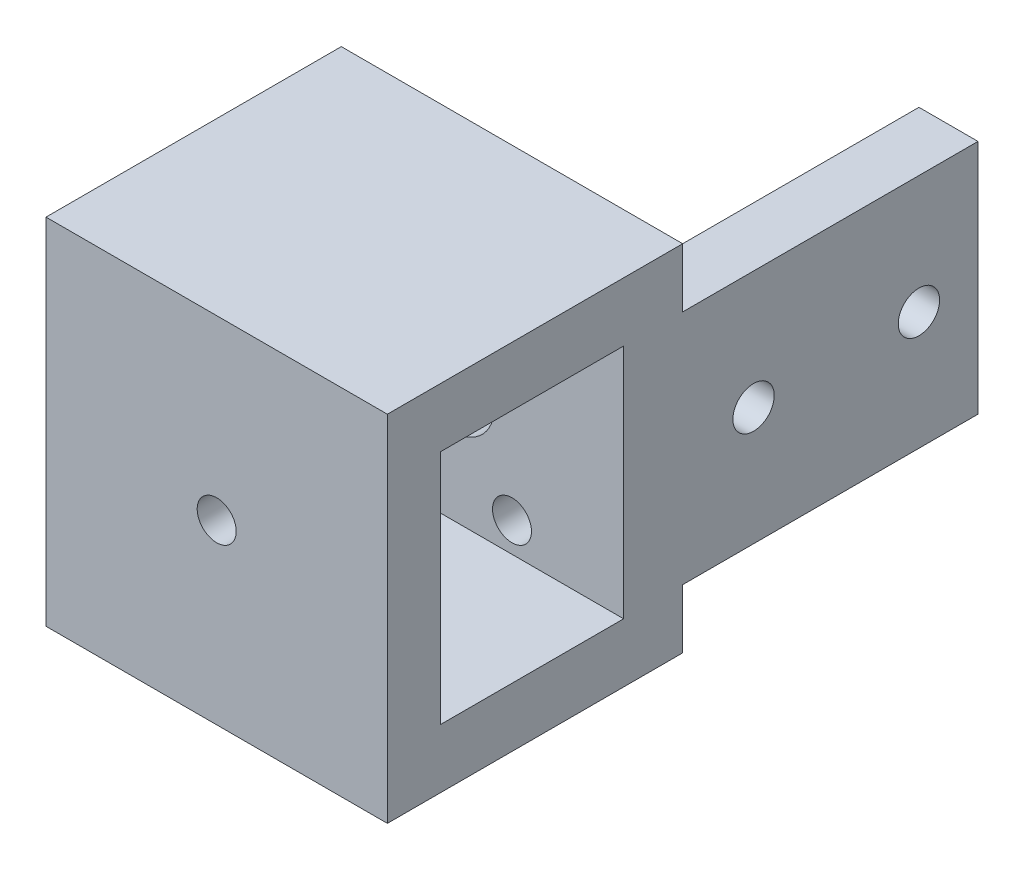
from build123d import *

# Parameters (mm, degrees)
SKETCH_1_W          = 28.9
SKETCH_1_H          = 20
SKETCH_1_R          = 1.65
EXTRUDE_1_DEPTH     = 5
SKETCH_1_5_W        = 28.9
SKETCH_1_5_H        = 5
EXTRUDE_4_DEPTH     = 25
SKETCH_2_W          = 25
SKETCH_2_H          = 20
SKETCH_2_R          = 1.75
EXTRUDE_5_DEPTH     = 5
SKETCH_3_W          = 28.9
SKETCH_3_H          = 20
SKETCH_3_R          = 1.65
EXTRUDE_6_DEPTH     = 4.5
CUT_EXTRUDE_1_REACH = 61.418
SKETCH_4_R          = 3.5


with BuildPart() as part:
    # 草图1 → 凸台-拉伸1 (new body)
    with BuildSketch(Plane.XY):
        with Locations((14.45, 10)):
            Rectangle(SKETCH_1_W, SKETCH_1_H)
        with Locations((9.45, 2.5)):
            Circle(SKETCH_1_R, mode=Mode.SUBTRACT)
        with Locations((19.45, 2.5)):
            Circle(SKETCH_1_R, mode=Mode.SUBTRACT)
        with Locations((9.45, 17.5)):
            Circle(SKETCH_1_R, mode=Mode.SUBTRACT)
        with Locations((19.45, 17.5)):
            Circle(SKETCH_1_R, mode=Mode.SUBTRACT)
    extrude(amount=EXTRUDE_1_DEPTH)

    # 草图1<5> → 凸台-拉伸4 (add)
    with BuildSketch(Plane.XY):
        with Locations((14.45, 22.5)):
            Rectangle(SKETCH_1_5_W, SKETCH_1_5_H)
        with Locations((14.45, -2.5)):
            Rectangle(SKETCH_1_5_W, SKETCH_1_5_H)
    extrude(amount=EXTRUDE_4_DEPTH)

    # 草图2 → 凸台-拉伸5 (add)
    with BuildSketch(Plane(origin=(28.9, 0, 0), x_dir=(0, 0, -1), z_dir=(1, 0, 0))):
        with Locations((12.5, 10)):
            Rectangle(SKETCH_2_W, SKETCH_2_H)
        with Locations((20, 10)):
            Circle(SKETCH_2_R, mode=Mode.SUBTRACT)
        with Locations((6, 10)):
            Circle(SKETCH_2_R, mode=Mode.SUBTRACT)
    extrude(amount=-EXTRUDE_5_DEPTH)

    # 草图3 → 凸台-拉伸6 (add)
    with BuildSketch(Plane.XY.offset(25)):
        with Locations((14.45, 10)):
            Rectangle(SKETCH_3_W, SKETCH_3_H)
        with Locations((14.45, 10)):
            Circle(SKETCH_3_R, mode=Mode.SUBTRACT)
    extrude(amount=-EXTRUDE_6_DEPTH)

    # 草图4 → 切除-拉伸1 (cut, up to next)
    with BuildSketch(Plane(origin=(0, 0, 20.5), x_dir=(-1, 0, 0), z_dir=(0, 0, -1)), mode=Mode.PRIVATE) as cut_extrude_1_sk1:
        with Locations((-14.45, 10)):
            Circle(SKETCH_4_R)
    cut_extrude_1_tool1 = extrude(cut_extrude_1_sk1.sketch, amount=CUT_EXTRUDE_1_REACH, mode=Mode.PRIVATE) & part.part
    add(cut_extrude_1_tool1.solids().sort_by_distance((14.45, 10, 20.5))[0], mode=Mode.SUBTRACT)


solid = part.part
